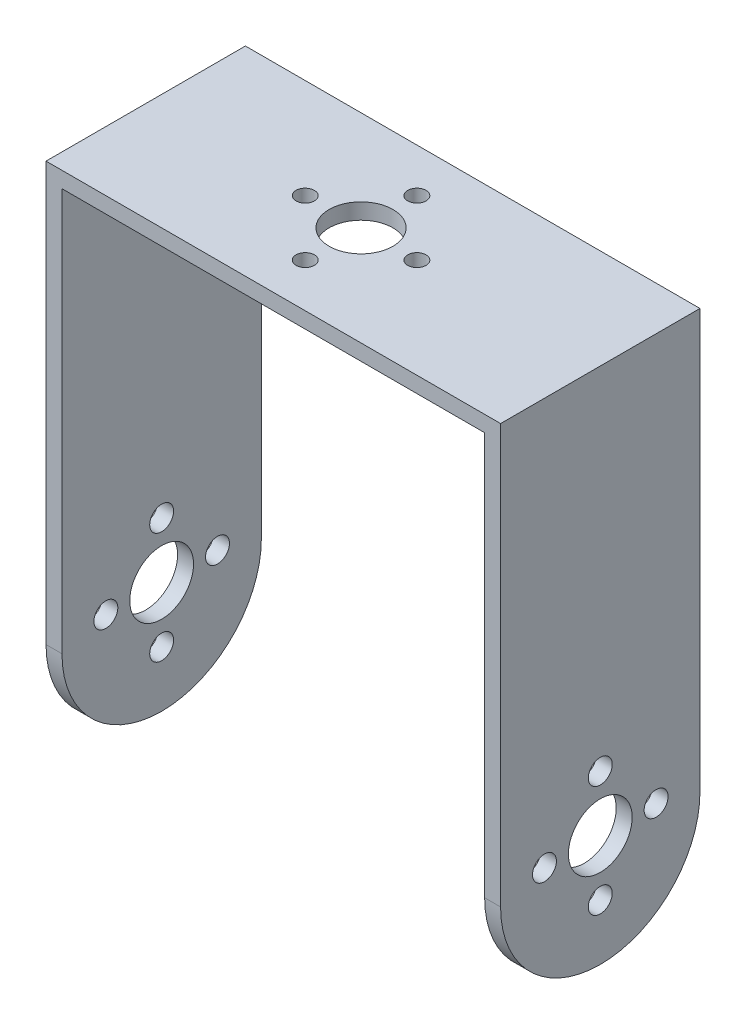
from build123d import *

# Parameters (mm, degrees)
BOSS_EXTRUDE2_DEPTH = 25
SKETCH4_R           = 4
CUT_EXTRUDE1_DEPTH  = 108.5257706
SKETCH6_R           = 4
CUT_EXTRUDE2_DEPTH  = 78.032036302
CUT_EXTRUDE3_DEPTH  = 78.032036302
SKETCH9_R           = 1.5
CUT_EXTRUDE4_DEPTH  = 78.032036302
SKETCH10_R          = 1.150035119
CUT_EXTRUDE5_DEPTH  = 108.5257706


with BuildPart() as part:
    # Sketch3 → Boss-Extrude2 (new body)
    with BuildSketch(Plane.XY):
        Polygon((-79.925523148, 45.386502584), (-27.042967192, 45.386502584), (-24.925523148, 45.386502584), (-24.925523148, -19.613497416), (-26.925523148, -19.613497416), (-26.925523148, 43.389953837), (-79.925523148, 43.389953837), (-79.925523148, -19.613497416), (-81.925523148, -19.613497416), (-81.925523148, 45.386502584), align=None)
    extrude(amount=BOSS_EXTRUDE2_DEPTH)

    # Sketch4 → Cut-Extrude1 (cut, through all)
    with BuildSketch(Plane(origin=(0, 45.386502584, 0), x_dir=(1, 0, 0), z_dir=(0, 1, 0))):
        with Locations(Location((-54.925523148, -12.5, 0), (0, 0, 270))):
            Circle(SKETCH4_R)
    extrude(amount=-CUT_EXTRUDE1_DEPTH, mode=Mode.SUBTRACT)

    # Sketch6 → Cut-Extrude2 (cut, through all)
    with BuildSketch(Plane.ZY.offset(81.925523148)):
        with Locations(Location((12.5, -5.613497416, 0), (0, 0, 270))):
            Circle(SKETCH6_R)
    extrude(amount=-CUT_EXTRUDE2_DEPTH, mode=Mode.SUBTRACT)

    # Sketch8 → Cut-Extrude3 (cut, through all)
    with BuildSketch(Plane.ZY.offset(81.925523148)):
        with BuildLine():
            Line((0, -19.613497416), (12.5, -19.613497416))
            ThreePointArc((12.5, -19.613497416), (3.661165213, -15.952332159), (0, -7.113497352))
            Line((0, -7.113497352), (0, -19.613497416))
        make_face()
        with BuildLine():
            Line((12.5, -19.613497416), (25, -19.613497416))
            Line((25, -19.613497416), (25, -7.113497416))
            ThreePointArc((25, -7.113497416), (21.338834765, -15.952332181), (12.5, -19.613497416))
        make_face()
    extrude(amount=-CUT_EXTRUDE3_DEPTH, mode=Mode.SUBTRACT)

    # Sketch9 → Cut-Extrude4 (cut, through all)
    with BuildSketch(Plane(origin=(-24.925523148, 0, 0), x_dir=(0, 0, -1), z_dir=(1, 0, 0))):
        with Locations(Location((-12.5, 1.386502584, 0), (0, 0, 90))):
            Circle(SKETCH9_R)
        with Locations(Location((-5.5, -5.613497416, 0), (0, 0, 90))):
            Circle(SKETCH9_R)
        with Locations(Location((-12.5, -12.613497416, 0), (0, 0, 90))):
            Circle(SKETCH9_R)
        with Locations(Location((-19.5, -5.613497416, 0), (0, 0, 90))):
            Circle(SKETCH9_R)
    extrude(amount=-CUT_EXTRUDE4_DEPTH, mode=Mode.SUBTRACT)

    # Sketch10 → Cut-Extrude5 (cut, through all)
    with BuildSketch(Plane(origin=(0, 45.386502584, 0), x_dir=(1, 0, 0), z_dir=(0, 1, 0))):
        with Locations(Location((-54.925524223, -19.499998866, 0), (0, 0, 270))):
            Circle(SKETCH10_R)
        with Locations(Location((-61.925524223, -12.499998866, 0), (0, 0, 270))):
            Circle(SKETCH10_R)
        with Locations(Location((-54.925524223, -5.499998866, 0), (0, 0, 270))):
            Circle(SKETCH10_R)
        with Locations(Location((-47.925524223, -12.499998866, 0), (0, 0, 270))):
            Circle(SKETCH10_R)
    extrude(amount=-CUT_EXTRUDE5_DEPTH, mode=Mode.SUBTRACT)


solid = part.part
